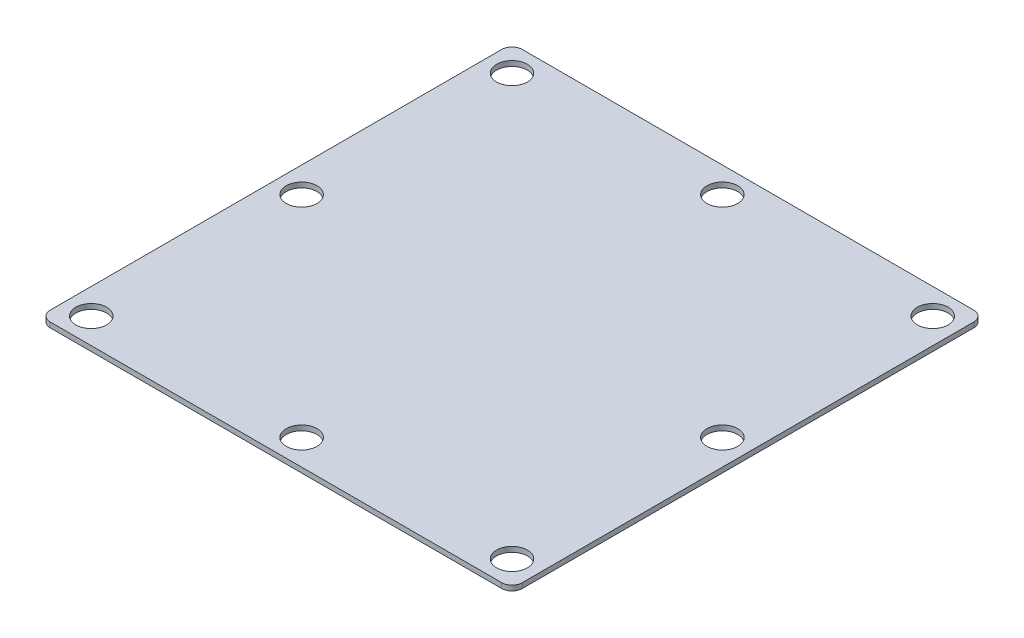
from build123d import *

# Parameters (mm, degrees)
SKETCH1_W               = 92
SKETCH1_H               = 92
BOSS_EXTRUDE1_DEPTH     = 0.5
FILLET1_R               = 2
CUT_EXTRUDE1_DEPTH      = 66.061509358
CUT_EXTRUDE1_DEPTH_BACK = 66.061509358
SKETCH2_R               = 3


with BuildPart() as part:
    # Sketch1 → Boss-Extrude1 (new, symmetric)
    with BuildSketch(Plane(origin=(0, 0, 0), x_dir=(1, 0, 0), z_dir=(0, 1, 0))):
        Rectangle(SKETCH1_W, SKETCH1_H)
    extrude(amount=BOSS_EXTRUDE1_DEPTH, both=True)

    # Fillet1
    fillet1_edges = [part.edges().sort_by_distance(p)[0] for p in [
        (46, 0, 46),
        (-46, 0, 46),
        (-46, 0, -46),
        (46, 0, -46),
    ]]
    fillet(fillet1_edges, radius=FILLET1_R)

    # Sketch2 → Cut-Extrude1 (cut, two sides: drawn at the far end of the back side and taken through both)
    with BuildSketch(Plane(origin=(0, 0.5, 0), x_dir=(1, 0, 0), z_dir=(0, 1, 0)).offset(-CUT_EXTRUDE1_DEPTH_BACK)):
        with Locations(Location((-41, 41, 0), (0, 0, 270))):
            Circle(SKETCH2_R)
        with Locations(Location((0, 41, 0), (0, 0, 270))):
            Circle(SKETCH2_R)
        with Locations(Location((41, 41, 0), (0, 0, 270))):
            Circle(SKETCH2_R)
        with Locations(Location((41, 0, 0), (0, 0, 270))):
            Circle(SKETCH2_R)
        with Locations(Location((41, -41, 0), (0, 0, 270))):
            Circle(SKETCH2_R)
        with Locations(Location((0, -41, 0), (0, 0, 270))):
            Circle(SKETCH2_R)
        with Locations(Location((-41, -41, 0), (0, 0, 270))):
            Circle(SKETCH2_R)
        with Locations(Location((-41, 0, 0), (0, 0, 270))):
            Circle(SKETCH2_R)
    extrude(amount=CUT_EXTRUDE1_DEPTH + CUT_EXTRUDE1_DEPTH_BACK, mode=Mode.SUBTRACT)


solid = part.part
